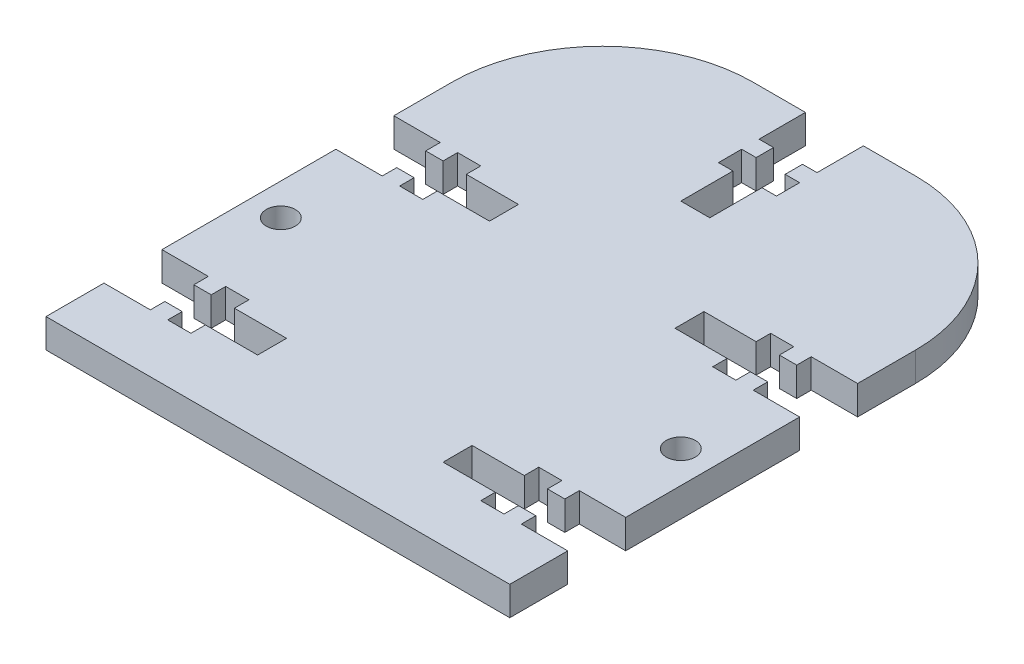
from build123d import *

# Parameters (mm, degrees)
SKETCH1_W            = 50.8
SKETCH1_H            = 60.96
BOSS_EXTRUDE2_DEPTH  = 3.175
CUT_EXTRUDE3_DEPTH   = 40.802902218
LPATTERN3_COUNT      = 2
LPATTERN3_PITCH      = 25.4
SKETCH6_R            = 1.5875
CUT_EXTRUDE4_DEPTH   = 40.802902218
MIRROR4_COPY_1_DEPTH = 40.802902218
CUT_EXTRUDE5_DEPTH   = 40.802902218
CUT_EXTRUDE6_DEPTH   = 40.802902218


with BuildPart() as part:
    # Sketch1 → Boss-Extrude2 (new body)
    with BuildSketch(Plane(origin=(0, 0, 0), x_dir=(1, 0, 0), z_dir=(0, 1, 0))):
        Rectangle(SKETCH1_W, SKETCH1_H)
    extrude(amount=BOSS_EXTRUDE2_DEPTH)

    # Sketch5 → Cut-Extrude3 (cut, through all)
    with BuildSketch(Plane(origin=(0, 3.175, 0), x_dir=(1, 0, 0), z_dir=(0, 1, 0))):
        Polygon((-20.32, 6.0325), (-18.415, 6.0325), (-18.415, 7.62), (-15.875, 7.62), (-15.875, 6.0325), (-10.16, 6.0325), (-10.16, 2.8575), (-15.875, 2.8575), (-15.875, 1.27), (-18.415, 1.27), (-18.415, 2.8575), (-20.32, 2.8575), (-20.32, 1.27), (-25.4, 1.27), (-25.4, 7.62), (-20.32, 7.62), align=None)
    cut_extrude3 = extrude(amount=-CUT_EXTRUDE3_DEPTH, mode=Mode.SUBTRACT)

    # LPattern3: Cut-Extrude3 ×2
    with Locations(*[(0, 0, i * LPATTERN3_PITCH) for i in range(1, LPATTERN3_COUNT)]):
        add(cut_extrude3, mode=Mode.SUBTRACT)

    # Sketch6 → Cut-Extrude4 (cut, through all)
    with BuildSketch(Plane(origin=(0, 3.175, 0), x_dir=(1, 0, 0), z_dir=(0, 1, 0))):
        with Locations(Location((-21.9075, -8.255, 0), (0, 0, 270))):
            Circle(SKETCH6_R)
    cut_extrude4 = extrude(amount=-CUT_EXTRUDE4_DEPTH, mode=Mode.SUBTRACT)

    # Mirror4: Cut-Extrude3, Cut-Extrude4 across plane
    add(cut_extrude3.mirror(Plane(origin=(0, 0, 0), x_dir=(0, 0, 1), z_dir=(1, 0, 0))), mode=Mode.SUBTRACT)
    add(cut_extrude4.mirror(Plane(origin=(0, 0, 0), x_dir=(0, 0, 1), z_dir=(1, 0, 0))), mode=Mode.SUBTRACT)

    # Mirror4 copy 1 sketch → Mirror4 copy 1 (cut, through all)
    with BuildSketch(Plane(origin=(0, 3.175, 25.4), x_dir=(-1, 0, 0), z_dir=(0, 1, 0))):
        Polygon((-20.32, -6.0325), (-18.415, -6.0325), (-18.415, -7.62), (-15.875, -7.62), (-15.875, -6.0325), (-10.16, -6.0325), (-10.16, -2.8575), (-15.875, -2.8575), (-15.875, -1.27), (-18.415, -1.27), (-18.415, -2.8575), (-20.32, -2.8575), (-20.32, -1.27), (-25.4, -1.27), (-25.4, -7.62), (-20.32, -7.62), align=None)
    extrude(amount=-MIRROR4_COPY_1_DEPTH, mode=Mode.SUBTRACT)

    # Sketch7 → Cut-Extrude5 (cut, through all)
    with BuildSketch(Plane(origin=(0, 3.175, 0), x_dir=(1, 0, 0), z_dir=(0, 1, 0))):
        Polygon((-3.175, 30.48), (-3.175, 25.4), (-1.5875, 25.4), (-1.5875, 23.495), (-3.175, 23.495), (-3.175, 20.955), (-1.5875, 20.955), (-1.5875, 15.24), (1.5875, 15.24), (1.5875, 20.955), (3.175, 20.955), (3.175, 23.495), (1.5875, 23.495), (1.5875, 25.4), (3.175, 25.4), (3.175, 30.48), align=None)
    extrude(amount=-CUT_EXTRUDE5_DEPTH, mode=Mode.SUBTRACT)

    # Sketch10 → Cut-Extrude6 (cut, through all)
    with BuildSketch(Plane(origin=(0, 3.175, 0), x_dir=(1, 0, 0), z_dir=(0, 1, 0))):
        with BuildLine():
            Line((-25.4, 13.97), (-25.4, 30.48))
            Line((-25.4, 30.48), (-8.89, 30.48))
            ThreePointArc((-8.89, 30.48), (-20.564332957, 25.644332957), (-25.4, 13.97))
        make_face()
        with BuildLine():
            Line((25.4, 13.97), (25.4, 30.48))
            Line((25.4, 30.48), (8.89, 30.48))
            ThreePointArc((8.89, 30.48), (20.564332957, 25.644332957), (25.4, 13.97))
        make_face()
    extrude(amount=-CUT_EXTRUDE6_DEPTH, mode=Mode.SUBTRACT)


solid = part.part
